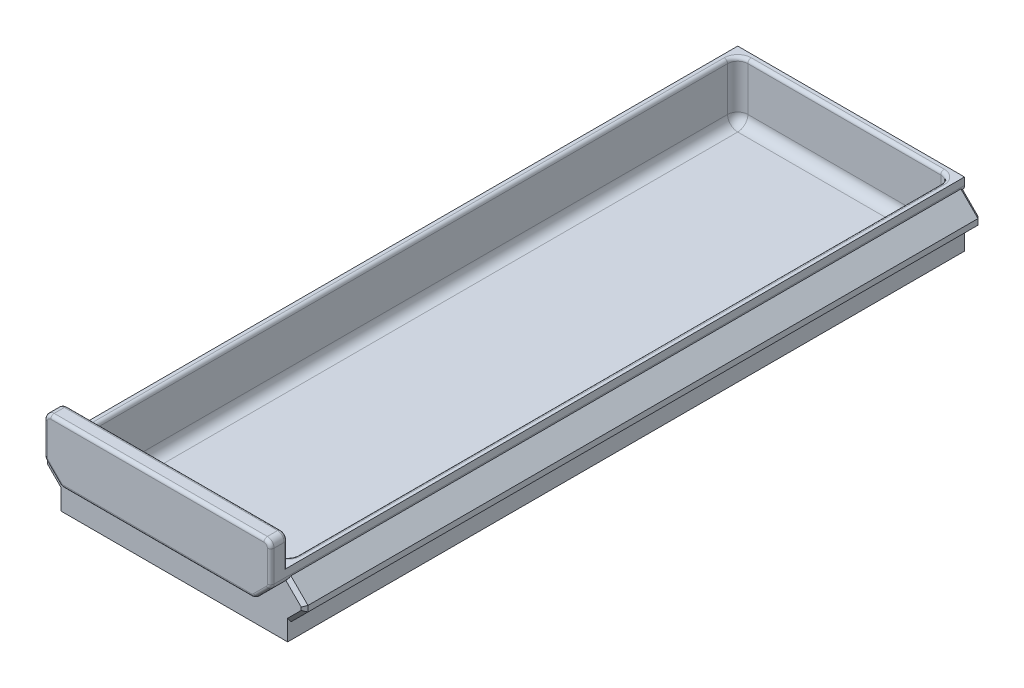
from build123d import *

# Parameters (mm, degrees)
EXTRUDE_1_DEPTH     = 200
SKETCH_2_W          = 63
SKETCH_2_H          = 196
CUT_EXTRUDE_1_DEPTH = 17
SKETCH_3_W          = 67
SKETCH_3_H          = 17
EXTRUDE_2_DEPTH     = 5
CHAMFER_1_SIZE      = 5
FILLET_1_R          = 2
FILLET_2_R          = 1
FILLET_3_R          = 3
FILLET_4_R          = 1
CHAMFER_2_SIZE      = 1


with BuildPart() as part:
    # 草图1 → 凸台-拉伸1 (new body)
    with BuildSketch(Plane.XY):
        Polygon((-73, 28), (-6, 28), (-6, 32.656854249), (-1, 37.656854249), (-1, 39.353196257), (-6, 44.353196257), (-6, 47), (-73, 47), (-73, 44.353196257), (-78, 39.353196257), (-78, 37.656854249), (-73, 32.656854249), align=None)
    extrude(amount=-EXTRUDE_1_DEPTH)

    # 草图2 → 切除-拉伸1 (cut)
    with BuildSketch(Plane(origin=(0, 47, 0), x_dir=(1, 0, 0), z_dir=(0, 1, 0))):
        with Locations((-39.5, 100)):
            Rectangle(SKETCH_2_W, SKETCH_2_H)
    extrude(amount=-CUT_EXTRUDE_1_DEPTH, mode=Mode.SUBTRACT)

    # 草图3 → 凸台-拉伸2 (add)
    with BuildSketch(Plane.XY):
        with Locations((-39.5, 47.5)):
            Rectangle(SKETCH_3_W, SKETCH_3_H)
    extrude(amount=EXTRUDE_2_DEPTH)

    # 倒角1
    chamfer_1_edges = [part.edges().sort_by_distance(p)[0] for p in [
        (-73, 39, 2.5),
        (-6, 39, 2.5),
    ]]
    chamfer(chamfer_1_edges, length=CHAMFER_1_SIZE)

    # 圆角1
    fillet_1_edges = [part.edges().sort_by_distance(p)[0] for p in [
        (-6, 56, 2.5),
        (-6, 44, 2.5),
        (-11, 39, 2.5),
        (-68, 39, 2.5),
        (-73, 44, 2.5),
        (-73, 56, 2.5),
    ]]
    fillet(fillet_1_edges, radius=FILLET_1_R)

    # 圆角2
    fillet_2_edges = [part.edges().sort_by_distance(p)[0] for p in [
        (-6, 50.5, 0),
        (-39.5, 56, 0),
        (-39.5, 56, 5),
        (-73, 50.5, 0),
        (-72.414213562, 55.414213562, 0),
        (-6.585786438, 55.414213562, 0),
        (-6, 49.414213562, 5),
        (-39.5, 39, 5),
        (-8.5, 41.5, 5),
        (-73, 49.414213562, 5),
        (-70.5, 41.5, 5),
        (-72.414213562, 55.414213562, 5),
        (-72.847759065, 44.06306026, 5),
        (-67.93693974, 39.152240935, 5),
        (-11.06306026, 39.152240935, 5),
        (-6.152240935, 44.06306026, 5),
        (-6.585786438, 55.414213562, 5),
    ]]
    fillet(fillet_2_edges, radius=FILLET_2_R)

    # 圆角3
    fillet_3_edges = [part.edges().sort_by_distance(p)[0] for p in [
        (-39.5, 30, -2),
        (-8, 38.5, -2),
        (-8, 30, -100),
        (-8, 38.5, -198),
        (-39.5, 30, -198),
        (-71, 38.5, -198),
        (-71, 30, -100),
        (-71, 38.5, -2),
    ]]
    fillet(fillet_3_edges, radius=FILLET_3_R)

    # 圆角4
    fillet_4_edges = [part.edges().sort_by_distance(p)[0] for p in [
        (-39.5, 47, -198),
        (-8, 47, -100),
        (-39.5, 47, -2),
        (-71, 47, -100),
        (-8.878679656, 47, -2.878679656),
        (-8.878679656, 47, -197.121320344),
        (-70.121320344, 47, -2.878679656),
        (-70.121320344, 47, -197.121320344),
    ]]
    fillet(fillet_4_edges, radius=FILLET_4_R)

    # 倒角2
    chamfer_2_edges = [part.edges().sort_by_distance(p)[0] for p in [
        (-75.5, 35.156854249, 0),
        (-78, 38.505025253, 0),
        (-75.476752896, 41.876443361, 0),
        (-3.523247104, 41.876443361, 0),
        (-1, 38.505025253, 0),
        (-3.5, 35.156854249, 0),
        (-3.5, 35.156854249, -200),
        (-1, 38.505025253, -200),
        (-3.523247104, 41.876443361, -200),
        (-75.476752896, 41.876443361, -200),
        (-78, 38.505025253, -200),
        (-75.5, 35.156854249, -200),
    ]]
    chamfer(chamfer_2_edges, length=CHAMFER_2_SIZE)


solid = part.part
